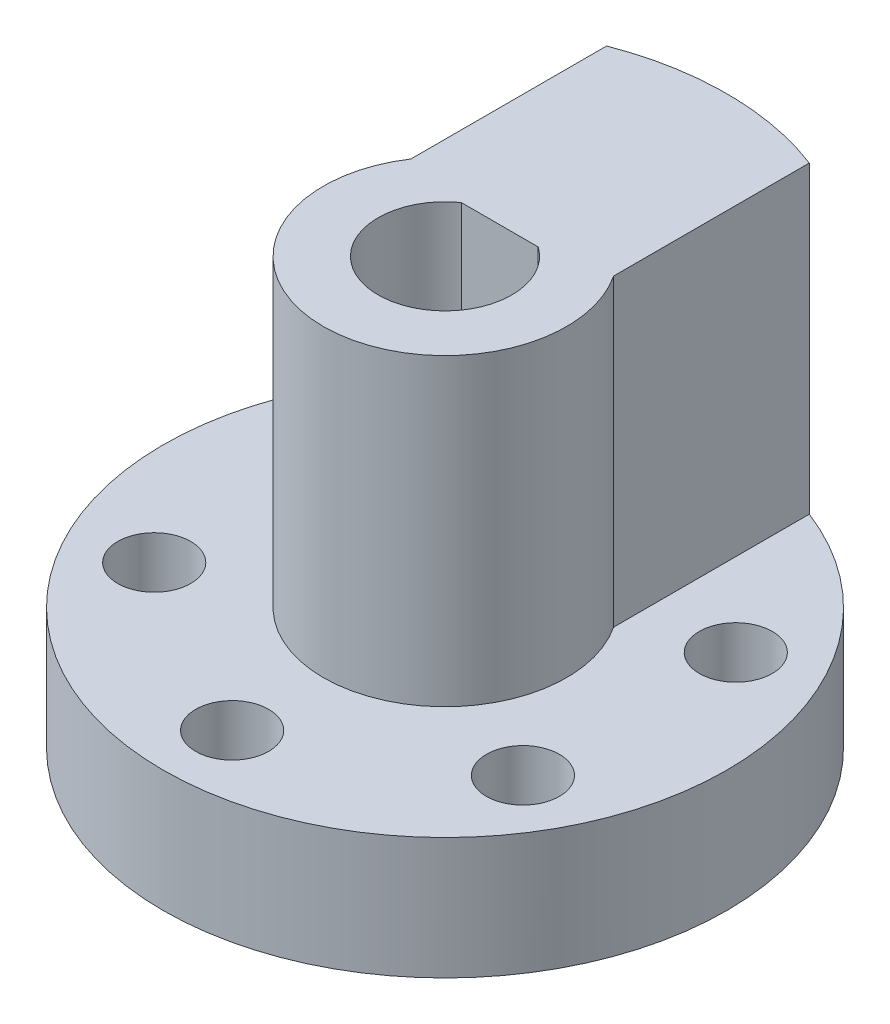
from build123d import *

# Parameters (mm, degrees)
ESQUISSE3_R             = 13.9
ESQUISSE3_R_2           = 1.8
BOSS_EXTRU_1_DEPTH      = 6
ESQUISSE5_R             = 6
BOSS_EXTRU_2_DEPTH      = 15
ENL_V_MAT_EXTRU_2_DEPTH = 11.8
BOSS_EXTRU_3_REACH      = 37.097
BOSS_EXTRU_3_END_RADIUS = 13.9
BOSS_EXTRU_3_START      = -3
ESQUISSE7_W             = 10
ESQUISSE7_H             = 15
ESQUISSE11_R            = 2.2
ENL_V_MAT_EXTRU_3_DEPTH = 14
ENL_V_START             = -5
ENL_V_MAT_EXTRU_4_DEPTH = 3.5


with BuildPart() as part:
    # Esquisse3 → Boss.-Extru.1 (new body)
    with BuildSketch(Plane(origin=(0, 0, 0), x_dir=(1, 0, 0), z_dir=(0, 1, 0))):
        with Locations(Location((0, 0, 0), (0, 0, 270))):
            Circle(ESQUISSE3_R)
        with Locations(Location((0, 10.5, 0), (0, 0, 270))):
            Circle(ESQUISSE3_R_2, mode=Mode.SUBTRACT)
        with Locations(Location((9.09326674, 5.25, 0), (0, 0, 270))):
            Circle(ESQUISSE3_R_2, mode=Mode.SUBTRACT)
        with Locations(Location((9.09326674, -5.25, 0), (0, 0, 270))):
            Circle(ESQUISSE3_R_2, mode=Mode.SUBTRACT)
        with Locations(Location((0, -10.5, 0), (0, 0, 270))):
            Circle(ESQUISSE3_R_2, mode=Mode.SUBTRACT)
        with Locations(Location((-9.09326674, -5.25, 0), (0, 0, 270))):
            Circle(ESQUISSE3_R_2, mode=Mode.SUBTRACT)
        with Locations(Location((-9.09326674, 5.25, 0), (0, 0, 270))):
            Circle(ESQUISSE3_R_2, mode=Mode.SUBTRACT)
    extrude(amount=BOSS_EXTRU_1_DEPTH)

    # Esquisse5 → Boss.-Extru.2 (add)
    with BuildSketch(Plane(origin=(0, 6, 0), x_dir=(1, 0, 0), z_dir=(0, 1, 0))):
        with Locations(Location((0, 0, 0), (0, 0, 270))):
            Circle(ESQUISSE5_R)
    extrude(amount=BOSS_EXTRU_2_DEPTH)

    # Esquisse6 → Enlèv. mat.-Extru.2 (cut)
    with BuildSketch(Plane(origin=(0, 21, 0), x_dir=(1, 0, 0), z_dir=(0, 1, 0))):
        with BuildLine():
            Line((-1.897366596, 2.7), (1.897366596, 2.7))
            ThreePointArc((1.897366596, 2.7), (0, -3.3), (-1.897366596, 2.7))
        make_face()
    extrude(amount=-ENL_V_MAT_EXTRU_2_DEPTH, mode=Mode.SUBTRACT)

    # Boss.-Extru.3: up to this cylinder (the profile starts inside it)
    boss_extru_3_end = Plane(origin=(0, 13.5, 0), z_dir=(0, -1, 0)) * Cylinder(BOSS_EXTRU_3_END_RADIUS, 102.994, mode=Mode.PRIVATE)
    # Esquisse7 → Boss.-Extru.3 (add, up to the surface)
    with BuildSketch(Plane(origin=(0, 0, -6), x_dir=(-1, 0, 0), z_dir=(0, 0, -1)).offset(BOSS_EXTRU_3_START), mode=Mode.PRIVATE) as boss_extru_3_sk1:
        with Locations((0, 13.5)):
            Rectangle(ESQUISSE7_W, ESQUISSE7_H)
    boss_extru_3_tool1 = extrude(boss_extru_3_sk1.sketch, amount=BOSS_EXTRU_3_REACH, mode=Mode.PRIVATE) & boss_extru_3_end
    add(boss_extru_3_tool1.solids().sort_by_distance((0, 13.5, -3))[0])

    # Esquisse11 → Enlèv. mat.-Extru.3 (cut)
    with BuildSketch(Plane(origin=(0, 0, -13.9), x_dir=(-1, 0, 0), z_dir=(0, 0, -1))):
        with Locations(Location((0, 12.707359669, 0), (0, 0, 329.591587588))):
            Circle(ESQUISSE11_R)
    extrude(amount=-ENL_V_MAT_EXTRU_3_DEPTH, mode=Mode.SUBTRACT)

    # Esquisse12 → Enlèv. mat.-Extru.4 (cut)
    with BuildSketch(Plane(origin=(0, 0, -13.9), x_dir=(-1, 0, 0), z_dir=(0, 0, -1)).offset(ENL_V_START)):
        Polygon((0, 16.357656746), (-2.1075, 16.357656746), (-4.215, 12.707359669), (-2.1075, 9.057062592), (2.1075, 9.057062592), (5, 9.057062592), (5, 16.357656746), align=None)
    extrude(amount=-ENL_V_MAT_EXTRU_4_DEPTH, mode=Mode.SUBTRACT)


solid = part.part
